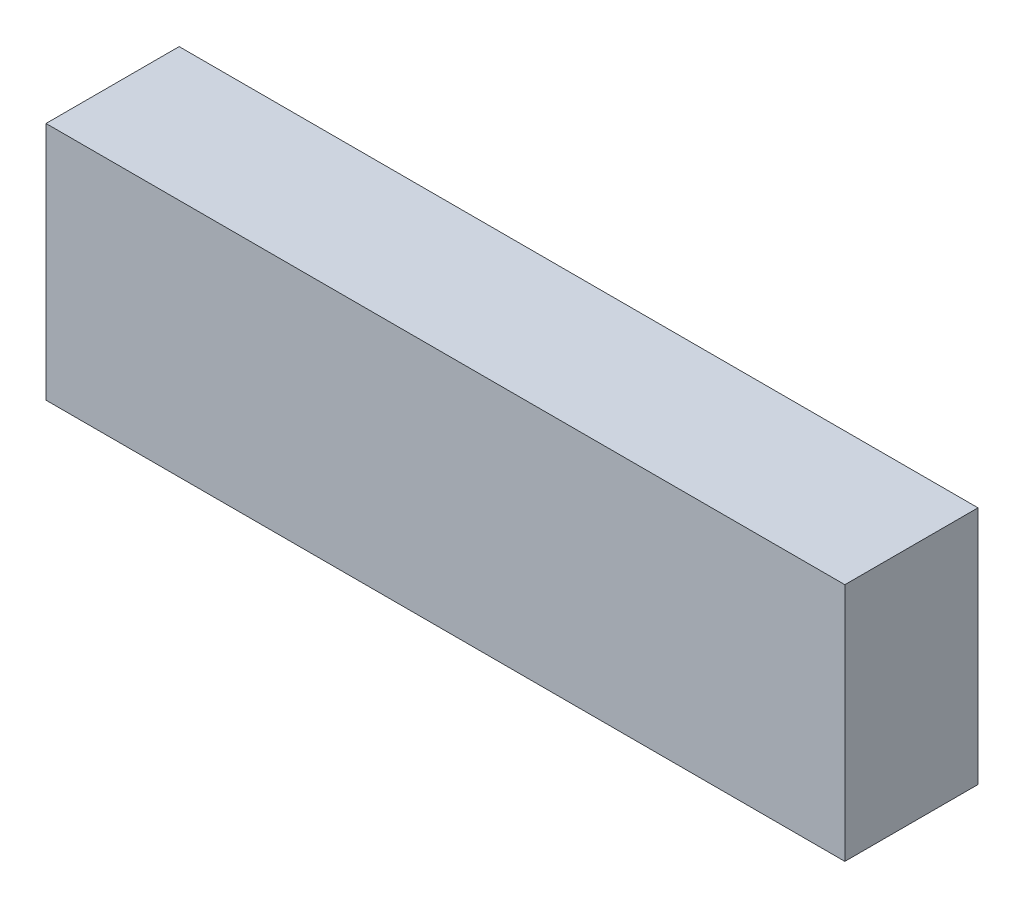
from build123d import *

# Parameters (mm, degrees)
SKETCH1_W           = 180
SKETCH1_H           = 54
BOSS_EXTRUDE1_DEPTH = 30


with BuildPart() as part:
    # Sketch1 → Boss-Extrude1 (new body)
    with BuildSketch(Plane.XY):
        with Locations((14.363839286, 21.013392857)):
            Rectangle(SKETCH1_W, SKETCH1_H)
    extrude(amount=BOSS_EXTRUDE1_DEPTH)


solid = part.part
